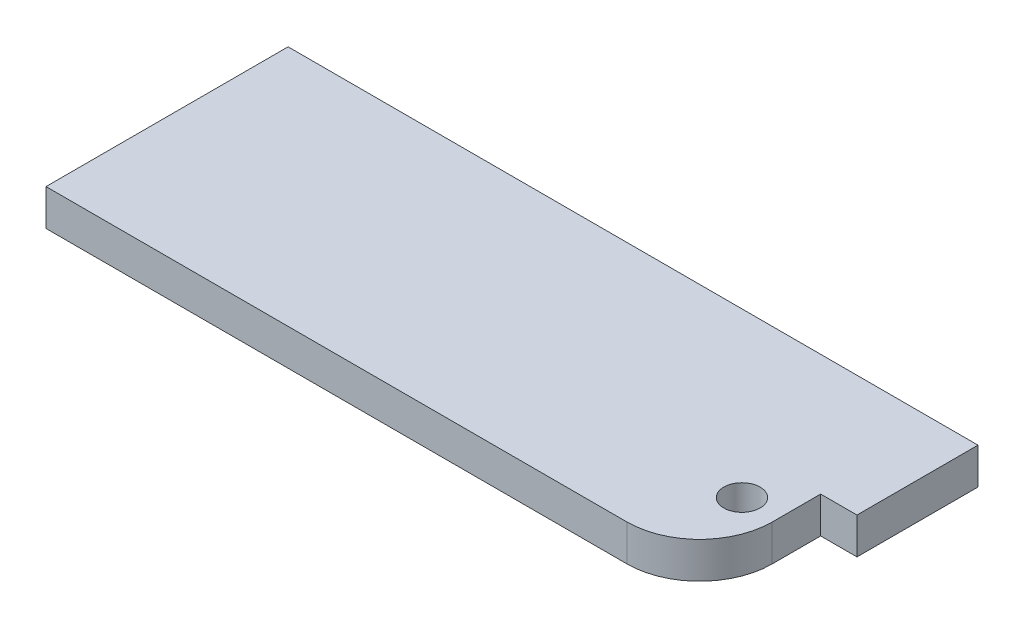
from build123d import *

# Parameters (mm, degrees)
SKETCH1_R           = 1.5
BOSS_EXTRUDE1_DEPTH = 3


with BuildPart() as part:
    # Sketch1 → Boss-Extrude1 (new body)
    with BuildSketch(Plane(origin=(0, 0, 0), x_dir=(1, 0, 0), z_dir=(0, 1, 0))):
        with BuildLine():
            Line((27, 10), (-27, 10))
            Line((-27, 10), (-27, -10))
            Line((-27, -10), (21, -10))
            ThreePointArc((21, -10), (25.242640687, -8.242640687), (27, -4))
            Line((27, -4), (27, 0))
            Line((27, 0), (30, 0))
            Line((30, 0), (30, 10))
            Line((30, 10), (27, 10))
        make_face()
        with Locations(Location((24, -3.5, 0), (0, 0, 270))):
            Circle(SKETCH1_R, mode=Mode.SUBTRACT)
    extrude(amount=BOSS_EXTRUDE1_DEPTH)


solid = part.part
